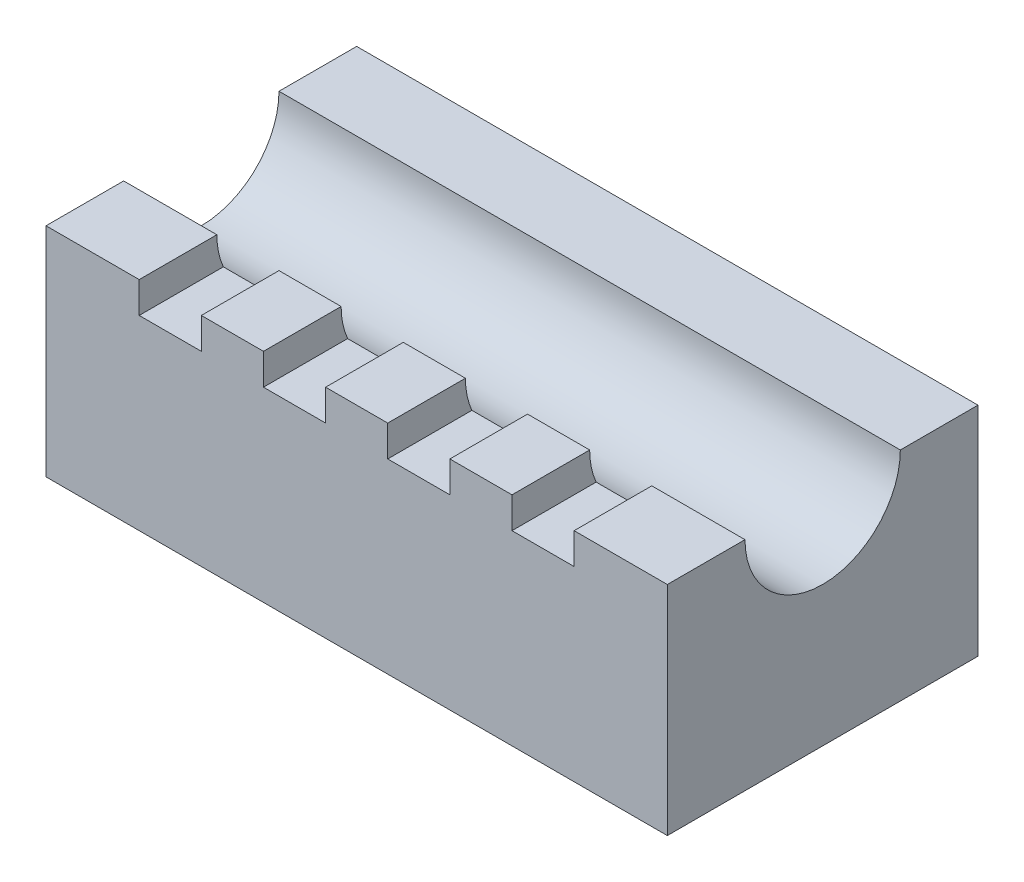
from build123d import *

# Parameters (mm, degrees)
SKETCH1_W           = 100
SKETCH1_H           = 50
BOSS_EXTRUDE1_DEPTH = 35
SKETCH2_R           = 12.5
CUT_EXTRUDE1_DEPTH  = 100
SKETCH5_W           = 10
SKETCH5_H           = 5
CUT_EXTRUDE3_DEPTH  = 25


with BuildPart() as part:
    # Sketch1 → Boss-Extrude1 (new body)
    with BuildSketch(Plane(origin=(0, 0, 0), x_dir=(1, 0, 0), z_dir=(0, 1, 0))):
        with Locations((50, 25)):
            Rectangle(SKETCH1_W, SKETCH1_H)
    extrude(amount=BOSS_EXTRUDE1_DEPTH)

    # Sketch2 → Cut-Extrude1 (cut)
    with BuildSketch(Plane(origin=(100, 0, 0), x_dir=(0, 0, -1), z_dir=(1, 0, 0))):
        with Locations((25, 35)):
            Circle(SKETCH2_R)
    extrude(amount=-CUT_EXTRUDE1_DEPTH, mode=Mode.SUBTRACT)

    # Sketch5 → Cut-Extrude3 (cut)
    with BuildSketch(Plane.XY):
        with Locations((20, 32.5)):
            Rectangle(SKETCH5_W, SKETCH5_H)
        with Locations((40, 32.5)):
            Rectangle(SKETCH5_W, SKETCH5_H)
        with Locations((60, 32.5)):
            Rectangle(SKETCH5_W, SKETCH5_H)
        with Locations((80, 32.5)):
            Rectangle(SKETCH5_W, SKETCH5_H)
    extrude(amount=-CUT_EXTRUDE3_DEPTH, mode=Mode.SUBTRACT)


solid = part.part
